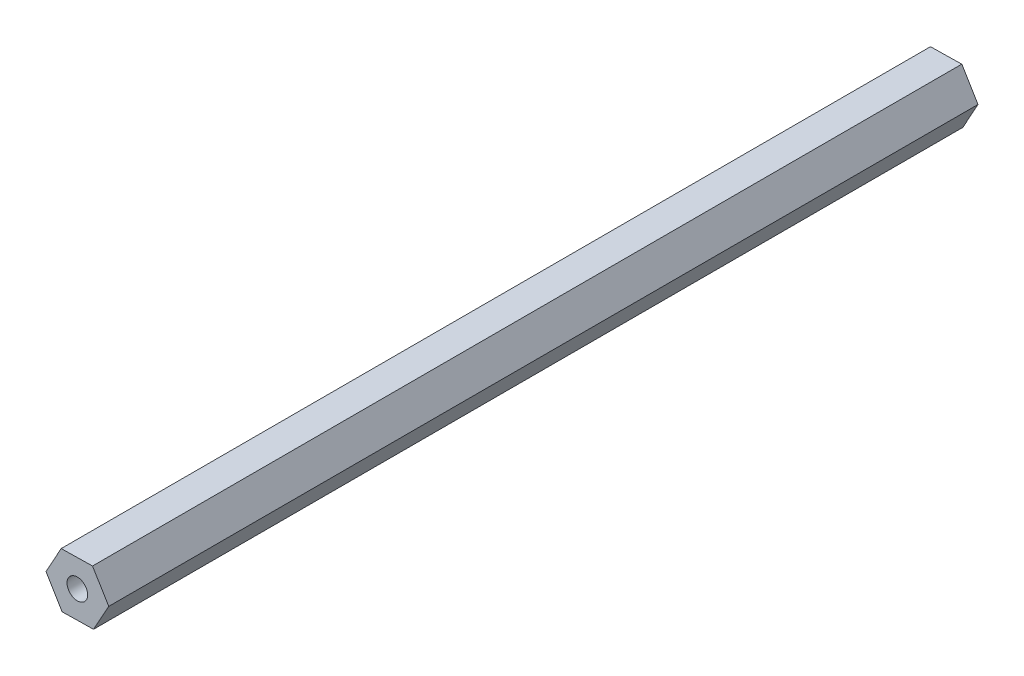
from build123d import *

# Parameters (mm, degrees)
SKETCH1_R           = 2.413
BOSS_EXTRUDE1_DEPTH = 203.2


with BuildPart() as part:
    # Sketch1 → Boss-Extrude1 (new body)
    with BuildSketch(Plane.XY):
        Polygon((3.784554112, -6.280165882), (7.33106025, 0.137437062), (3.546506138, 6.417602944), (-3.784554112, 6.280165882), (-7.33106025, -0.137437062), (-3.546506138, -6.417602944), align=None)
        Circle(SKETCH1_R, mode=Mode.SUBTRACT)
    extrude(amount=BOSS_EXTRUDE1_DEPTH)


solid = part.part
